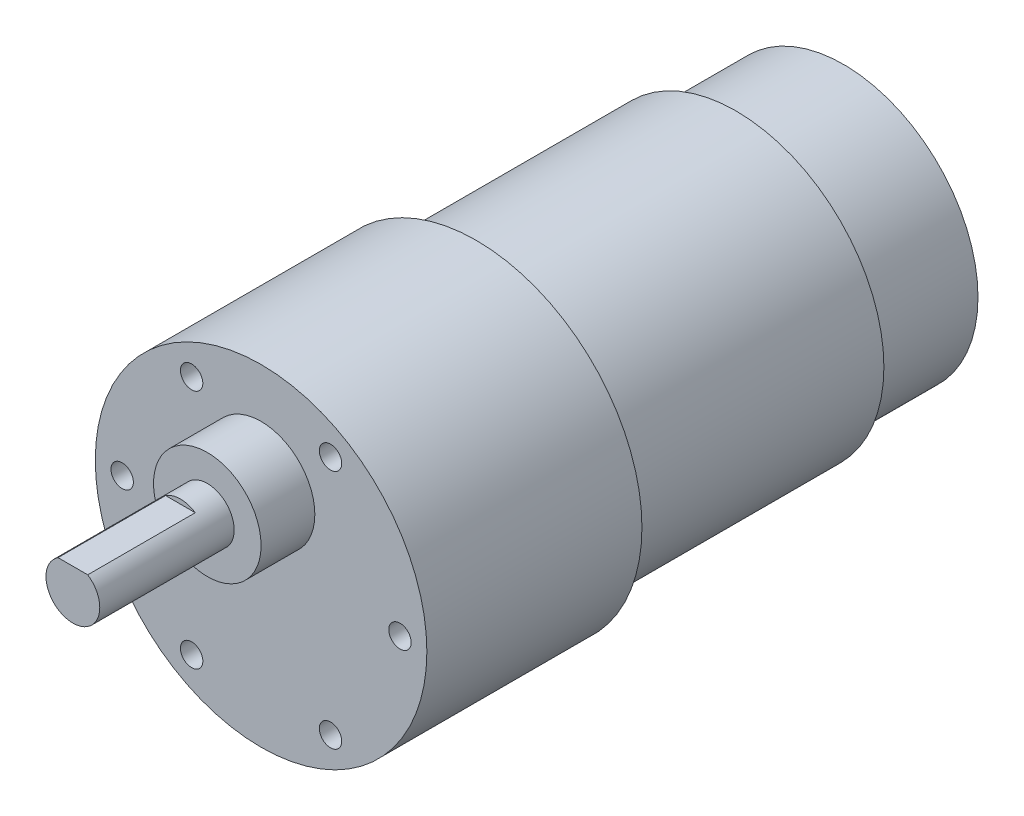
from build123d import *

# Parameters (mm, degrees)
GEARBOX_START          = -24
PROFILE_1_R            = 18.5
GEARBOX_DEPTH          = 24
THREAD_PILOTS_START    = -3.5
PROFILE_2_R            = 1.25
THREAD_PILOTS_DEPTH    = 3.51
ARMATURE_START         = -53
PROFILE_3_R            = 16.5
ARMATURE_DEPTH         = 29
ENCODER_ENVELOPE_START = -65
PROFILE_4_R            = 15
ENCODER_ENVELOPE_DEPTH = 12
PROFILE_5_R            = 6
NOSE_DEPTH             = 6
OUTPUT_START           = 6
PROFILE_6_R            = 3
OUTPUT_DEPTH           = 15
D_FLAT_START           = 9
PROFILE_7_W            = 8
PROFILE_7_H            = 1.5
D_FLAT_DEPTH           = 12.01


with BuildPart() as part:
    # Profile_1 → Gearbox (new body)
    with BuildSketch(Plane.XY.offset(GEARBOX_START)):
        with Locations((0, -7)):
            Circle(PROFILE_1_R)
    extrude(amount=GEARBOX_DEPTH)

    # Profile_2 → Thread_pilots (cut)
    with BuildSketch(Plane.XY.offset(THREAD_PILOTS_START)):
        with Locations((15.5, -7)):
            Circle(PROFILE_2_R)
        with Locations((7.75, 6.423393759)):
            Circle(PROFILE_2_R)
        with Locations((-7.75, 6.423393759)):
            Circle(PROFILE_2_R)
        with Locations((-15.5, -7)):
            Circle(PROFILE_2_R)
        with Locations((-7.75, -20.423393759)):
            Circle(PROFILE_2_R)
        with Locations((7.75, -20.423393759)):
            Circle(PROFILE_2_R)
    extrude(amount=THREAD_PILOTS_DEPTH, mode=Mode.SUBTRACT)

    # Profile_3 → Armature (add)
    with BuildSketch(Plane.XY.offset(ARMATURE_START)):
        with Locations(Location((0, -7, 0), (0, 0, 180))):
            Circle(PROFILE_3_R)
    extrude(amount=ARMATURE_DEPTH)

    # Profile_4 → Encoder_envelope (add)
    with BuildSketch(Plane.XY.offset(ENCODER_ENVELOPE_START)):
        with Locations((0, -7)):
            Circle(PROFILE_4_R)
    extrude(amount=ENCODER_ENVELOPE_DEPTH)

    # Profile_5 → Nose (add)
    with BuildSketch(Plane.XY):
        Circle(PROFILE_5_R)
    extrude(amount=NOSE_DEPTH)

    # Profile_6 → Output (add)
    with BuildSketch(Plane.XY.offset(OUTPUT_START)):
        Circle(PROFILE_6_R)
    extrude(amount=OUTPUT_DEPTH)

    # Profile_7 → D_flat (cut)
    with BuildSketch(Plane.XY.offset(D_FLAT_START)):
        with Locations((0, 3.25)):
            Rectangle(PROFILE_7_W, PROFILE_7_H)
    extrude(amount=D_FLAT_DEPTH, mode=Mode.SUBTRACT)


solid = part.part
